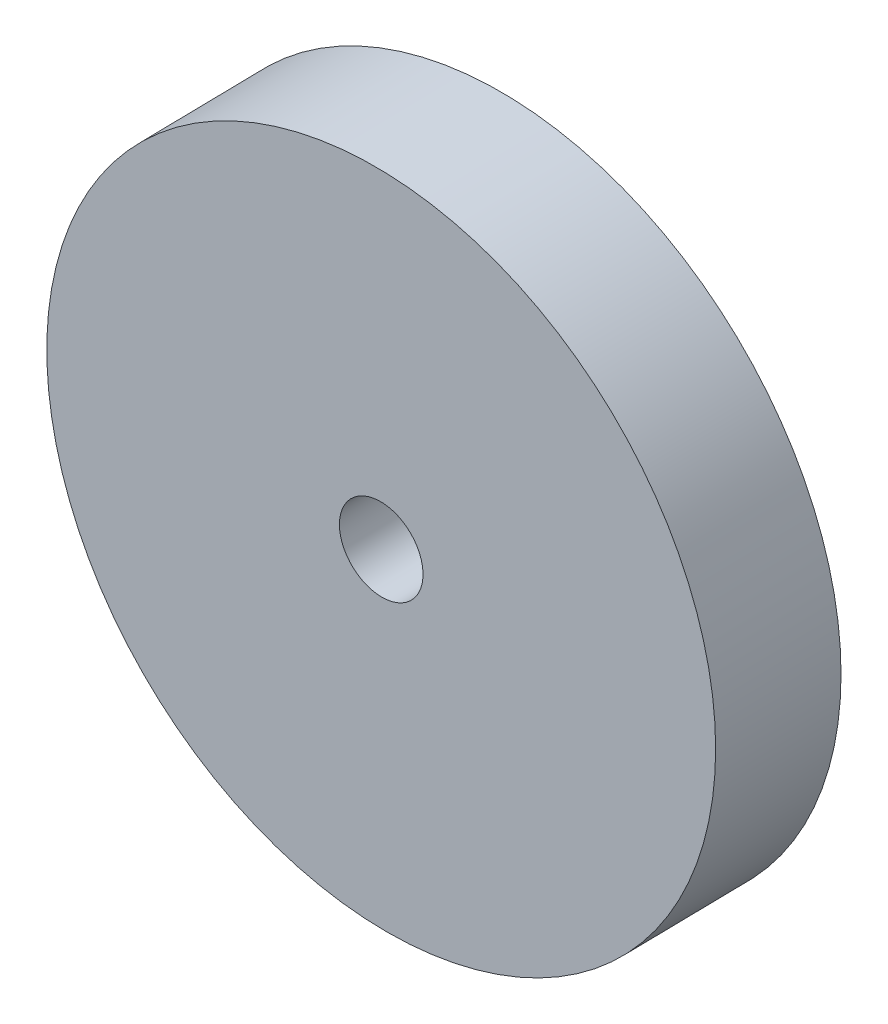
from build123d import *

# Parameters (mm, degrees)
SKETCH1_R             = 8
SKETCH1_R_2           = 1
BOSS_EXTRUDE1_DEPTH   = 3
BODY_MOVE_COPY1_ANGLE = 91


with BuildPart() as part:
    # Sketch1 → Boss-Extrude1 (new body)
    with BuildSketch(Plane(origin=(0, 0, 0), x_dir=(1, 0, 0), z_dir=(0, 1, 0))):
        with Locations(Location((0, 0, 0), (0, 0, 270))):
            Circle(SKETCH1_R)
        with Locations(Location((0, 0, 0), (0, 0, 270))):
            Circle(SKETCH1_R_2, mode=Mode.SUBTRACT)
    extrude(amount=BOSS_EXTRUDE1_DEPTH)


with BuildPart() as part_1:
    # Body-Move/Copy1: moved
    add(part.part.rotate(Axis((0, 1.5, 0), (1, 0, 0)), BODY_MOVE_COPY1_ANGLE))


solid = part_1.part
